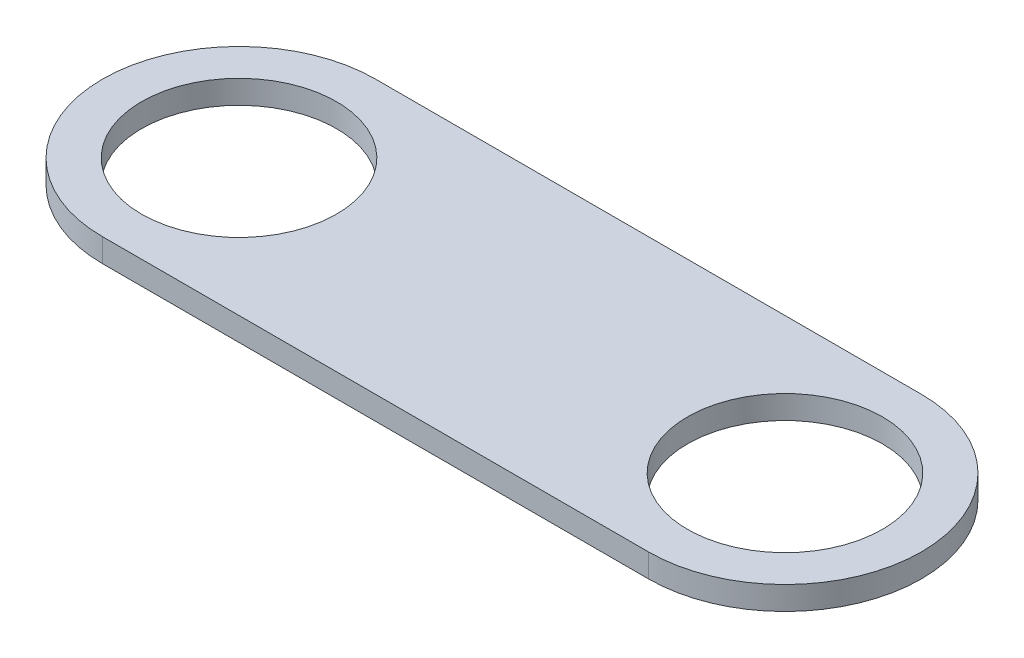
from build123d import *

# Parameters (mm, degrees)
BOSS_EXTRUDE1_DEPTH = 3
SKETCH2_R           = 12.5
CUT_EXTRUDE1_DEPTH  = 64.168425657


with BuildPart() as part:
    # Sketch1 → Boss-Extrude1 (new body)
    with BuildSketch(Plane(origin=(0, 0, 0), x_dir=(1, 0, 0), z_dir=(0, 1, 0))):
        with BuildLine():
            Line((35, 0), (-35, 0))
            ThreePointArc((-35, 0), (-52.5, -17.5), (-35, -35))
            Line((-35, -35), (35, -35))
            ThreePointArc((35, -35), (52.5, -17.5), (35, 0))
        make_face()
    extrude(amount=BOSS_EXTRUDE1_DEPTH)

    # Sketch2 → Cut-Extrude1 (cut, through all)
    with BuildSketch(Plane(origin=(0, 3, 0), x_dir=(1, 0, 0), z_dir=(0, 1, 0))):
        with Locations(Location((-35, -17.5, 0), (0, 0, 270))):
            Circle(SKETCH2_R)
        with Locations(Location((35, -17.5, 0), (0, 0, 90))):
            Circle(SKETCH2_R)
    extrude(amount=-CUT_EXTRUDE1_DEPTH, mode=Mode.SUBTRACT)


solid = part.part
